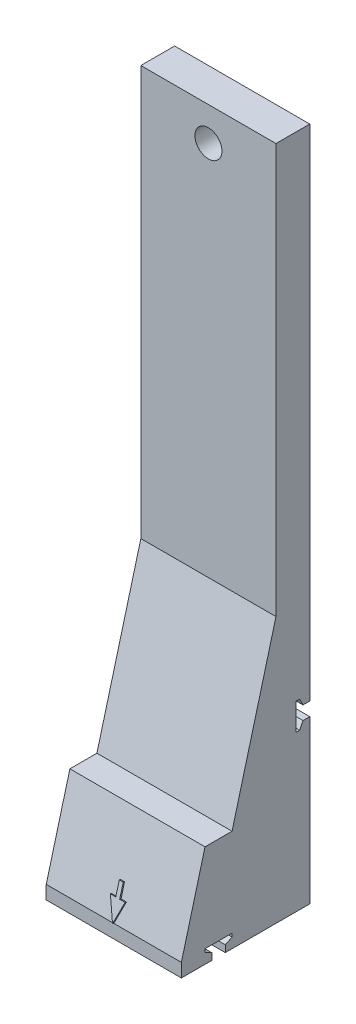
from build123d import *

# Parameters (mm, degrees)
EXTRUDE_1_DEPTH          = 100
CUT_EXTRUDE_1_DEPTH      = 1496.863705301
CUT_EXTRUDE_1_DEPTH_BACK = 1496.863705301
SKETCH_2_W               = 100
SKETCH_2_H               = 454.659308935
EXTRUDE_2_DEPTH          = 1
SKETCH_4_R               = 10
CUT_EXTRUDE_2_DEPTH      = 56


with BuildPart() as part:
    # 草图1 → 凸台-拉伸1 (new body)
    with BuildSketch(Plane(origin=(1150, 0, 0), x_dir=(0, 0, -1), z_dir=(1, 0, 0))):
        Polygon((-200, 50), (-200, 60), (-182.5, 125.310889132), (-162.5, 125.310889132), (-130, 246.602540378), (-130, 816.13921903), (-105, 816.13921903), (-105, 180), (-110, 180), (-112.5, 185), (-115, 185), (-115, 165), (-112.5, 165), (-110, 170), (-105, 170), (-105, 50), (-167.5, 50), (-167.5, 55), (-162.5, 57.5), (-162.5, 60), (-182.5, 60), (-182.5, 57.5), (-177.5, 55), (-177.5, 50), align=None)
    extrude(amount=EXTRUDE_1_DEPTH)

    # 草图2 → 切除-拉伸1 (cut, two sides: drawn at the far end of the back side and taken through both)
    with BuildSketch(Plane(origin=(0, 0, 105), x_dir=(-1, 0, 0), z_dir=(0, 0, -1)).offset(-CUT_EXTRUDE_1_DEPTH_BACK)):
        with Locations((-1200, 777.092271902)):
            Rectangle(SKETCH_2_W, SKETCH_2_H)
    extrude(amount=CUT_EXTRUDE_1_DEPTH + CUT_EXTRUDE_1_DEPTH_BACK, mode=Mode.SUBTRACT)

    # 草图3 → 凸台-拉伸2 (add)
    with BuildSketch(Plane(origin=(0, 54.019237886, 201.602540378), x_dir=(1, 0, 0), z_dir=(0, 0.2588190451025246, 0.9659258262890674))):
        Polygon((1200, 6.191740557), (1194.540446486, 21.191740557), (1198.540446486, 21.191740557), (1198.540446486, 31.191740557), (1201.459553514, 31.191740557), (1201.459553514, 21.191740557), (1205.459553514, 21.191740557), align=None)
    extrude(amount=EXTRUDE_2_DEPTH)

    # 草图4 → 切除-拉伸2 (cut)
    with BuildSketch(Plane.XY.offset(130)):
        with Locations((1200, 524.881308718)):
            Circle(SKETCH_4_R)
    extrude(amount=-CUT_EXTRUDE_2_DEPTH, mode=Mode.SUBTRACT)


solid = part.part
